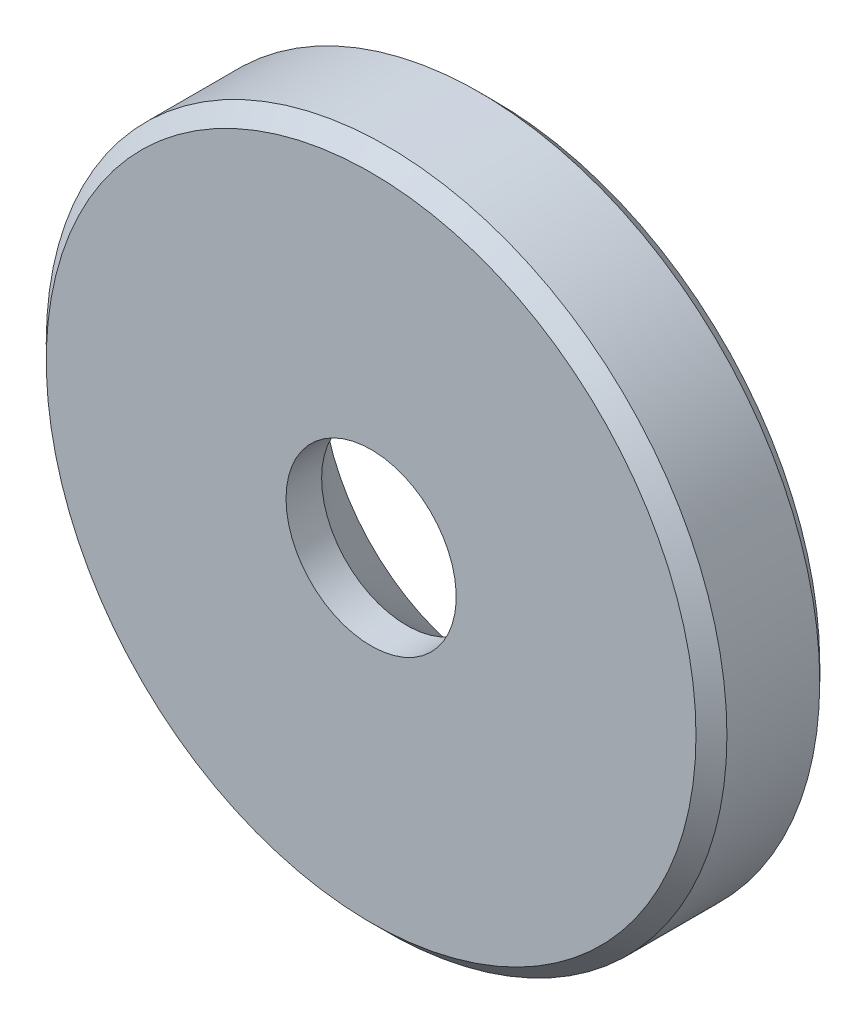
from build123d import *

# Parameters (mm, degrees)
SKETCH_1_R      = 11
EXTRUDE_1_DEPTH = 4
CHAMFER_1_SIZE  = 0.5


with BuildPart() as part:
    # 草图1 → 拉伸1 (new body)
    with BuildSketch(Plane.XY):
        Circle(SKETCH_1_R)
    extrude(amount=EXTRUDE_1_DEPTH)

    # 倒角1
    chamfer_1_edges = [part.edges().sort_by_distance(p)[0] for p in [
        (-11, 0, 0),
        (-11, 0, 4),
    ]]
    chamfer(chamfer_1_edges, length=CHAMFER_1_SIZE)

    # 草图2 → 打孔尺寸根据十字槽沉头木螺钉的类型1 (revolve, cut)
    with BuildSketch(Plane.YZ):
        Polygon((0, 0), (0, 4), (2.75, 4), (2.75, 2.85), (5.6, 0), align=None)
    revolve(axis=Axis((0, 0, -6.35), (0, 0, 1)), mode=Mode.SUBTRACT)


solid = part.part
